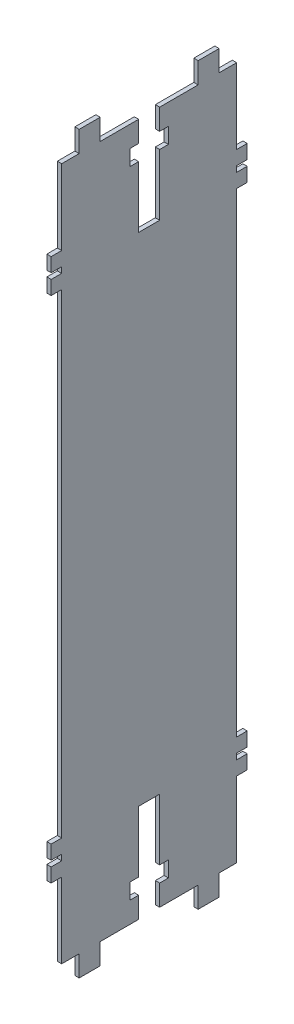
from build123d import *

# Parameters (mm, degrees)
BOSS_EXTRUDE1_DEPTH = 3


with BuildPart() as part:
    # Sketch1 → Boss-Extrude1 (new body)
    with BuildSketch(Plane(origin=(0, 0, 0), x_dir=(0, 0, -1), z_dir=(1, 0, 0))):
        Polygon((-60.50045, -173.90205), (-60.50045, -177.90205), (-67.76045, -177.90205), (-67.76045, -187.58145), (-60.50045, -187.58145), (-60.50045, -239.58145), (-48.39985, -239.58145), (-48.39985, -254.10145), (-33.88145, -254.10145), (-33.88145, -239.58145), (-7.26925, -239.58145), (-7.26925, -225.06305), (-13.31695, -225.06305), (-13.31695, -214.20305), (-7.26925, -214.20305), (-7.26925, -171.82185), (7.25255, -171.82185), (7.25255, -214.20305), (13.31025, -214.20305), (13.31025, -225.06305), (7.25255, -225.06305), (7.25255, -239.58145), (33.87975, -239.58145), (33.87975, -254.10145), (48.40145, -254.10145), (48.40145, -239.58145), (60.50045, -239.58145), (60.50045, -187.58145), (67.76045, -187.58145), (67.76045, -177.90205), (60.50045, -177.90205), (60.50045, -173.90205), (67.76045, -173.90205), (67.76045, -164.22265), (60.50045, -164.22265), (60.50045, 164.21755), (67.76045, 164.21755), (67.76045, 173.89865), (60.50045, 173.89865), (60.50045, 177.89865), (67.76045, 177.89865), (67.76045, 187.57975), (60.50045, 187.57975), (60.50045, 239.57975), (48.40145, 239.57975), (48.40145, 254.10145), (33.87975, 254.10145), (33.87975, 239.57975), (7.25255, 239.57975), (7.25255, 225.06305), (13.31025, 225.06305), (13.31025, 214.21475), (7.25255, 214.21475), (7.25255, 171.82185), (-7.26925, 171.82185), (-7.26925, 214.21475), (-13.31695, 214.21475), (-13.31695, 225.06305), (-7.26925, 225.06305), (-7.26925, 239.57975), (-33.88145, 239.57975), (-33.88145, 254.10145), (-48.39985, 254.10145), (-48.39985, 239.57975), (-60.50045, 239.57975), (-60.50045, 187.57975), (-67.76045, 187.57975), (-67.76045, 177.89865), (-60.50045, 177.89865), (-60.50045, 173.89865), (-67.76045, 173.89865), (-67.76045, 164.21755), (-60.50045, 164.21755), (-60.50045, -164.22265), (-67.76045, -164.22265), (-67.76045, -173.90205), align=None)
    extrude(amount=BOSS_EXTRUDE1_DEPTH)


solid = part.part
